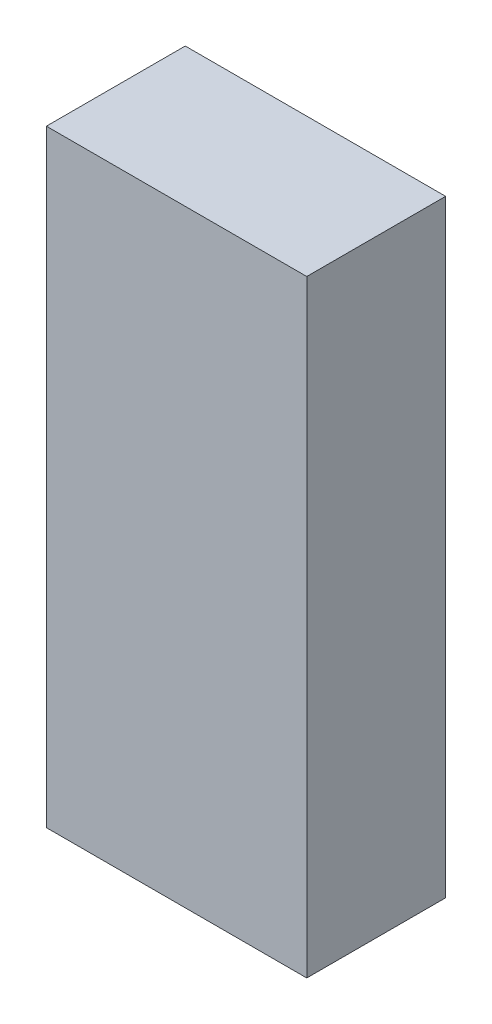
from build123d import *

# Parameters (mm, degrees)
SKETCH1_W           = 7.5
SKETCH1_H           = 17.5
BOSS_EXTRUDE1_DEPTH = 4


with BuildPart() as part:
    # Sketch1 → Boss-Extrude1 (new body)
    with BuildSketch(Plane.XY):
        with Locations((0, -8.75)):
            Rectangle(SKETCH1_W, SKETCH1_H)
    extrude(amount=BOSS_EXTRUDE1_DEPTH)


solid = part.part
